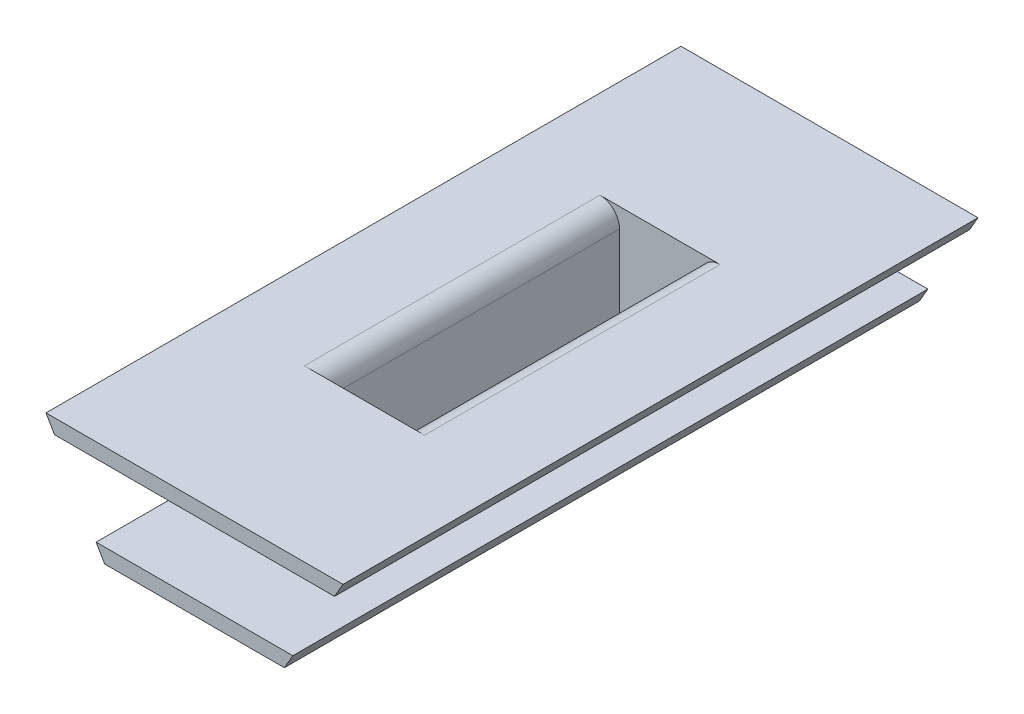
from build123d import *

# Parameters (mm, degrees)
CASING_W            = 8.3
CASING_H            = 7.392304845
BOSS_EXTRUDE2_DEPTH = 65
SKETCH10_W          = 10.3
SKETCH10_H          = 7.392395682
TOP_CUT_DEPTH       = 16.35
SKETCH11_W          = 10.3
SKETCH11_H          = 7.40522356
BOT_CUT_DEPTH       = 16.35
SKETCH13_W          = 8.3
SKETCH13_H          = 30.255654569
CUT_EXTRUDE8_DEPTH  = 68.55767906
FILLET1_R           = 1
FILLET2_R           = 2


with BuildPart() as part:
    # Casing → Boss-Extrude2 (new body)
    # profile 1 of 2: a face of its own
    with BuildSketch(Plane.XY):
        Polygon((-9.2, 0), (9.2, 0), (10.066025404, 1.5), (8.333974596, 1.5), (5.15, 1.5), (5.15, 8.892304845), (12.601923789, 8.892304845), (14.333974596, 8.892304845), (15.2, 10.392304845), (-15.2, 10.392304845), (-14.333974596, 8.892304845), (-12.601923789, 8.892304845), (-5.15, 8.892304845), (-5.15, 1.5), (-8.333974596, 1.5), (-10.066025404, 1.5), align=None)
        with Locations((0, 5.196152422)):
            Rectangle(CASING_W, CASING_H, mode=Mode.SUBTRACT)
    # profile 2 of 2: a face of its own
    with BuildSketch(Plane.XY):
        with Locations((0, 5.196152422)):
            Rectangle(CASING_W, CASING_H)
    extrude(amount=BOSS_EXTRUDE2_DEPTH)

    # Sketch10 → Top_Cut (cut)
    with BuildSketch(Plane.XY.offset(65)):
        with Locations((0, 5.196197841)):
            Rectangle(SKETCH10_W, SKETCH10_H)
    extrude(amount=-TOP_CUT_DEPTH, mode=Mode.SUBTRACT)

    # Sketch11 → Bot_Cut (cut)
    with BuildSketch(Plane(origin=(0, 0, 0), x_dir=(-1, 0, 0), z_dir=(0, 0, -1))):
        with Locations((0, 5.20261178)):
            Rectangle(SKETCH11_W, SKETCH11_H)
    extrude(amount=-BOT_CUT_DEPTH, mode=Mode.SUBTRACT)

    # Sketch13 → Cut-Extrude8 (cut, through all)
    with BuildSketch(Plane(origin=(0, 10.392304845, 0), x_dir=(1, 0, 0), z_dir=(0, 1, 0))):
        with Locations((0, -32.477827285)):
            Rectangle(SKETCH13_W, SKETCH13_H)
    extrude(amount=-CUT_EXTRUDE8_DEPTH, mode=Mode.SUBTRACT)

    # Fillet1
    fillet1_edges = [part.edges().sort_by_distance(p)[0] for p in [
        (-5.15, 5.196152423, 48.65),
        (5.15, 5.196152423, 48.65),
        (5.15, 5.196152423, 16.35),
        (-5.15, 5.196152423, 16.35),
    ]]
    fillet(fillet1_edges, radius=FILLET1_R)

    # Fillet2
    fillet2_edges = [part.edges().sort_by_distance(p)[0] for p in [
        (4.15, 10.392304845, 32.477827285),
        (-4.15, 10.392304845, 32.477827285),
    ]]
    fillet(fillet2_edges, radius=FILLET2_R)


solid = part.part
